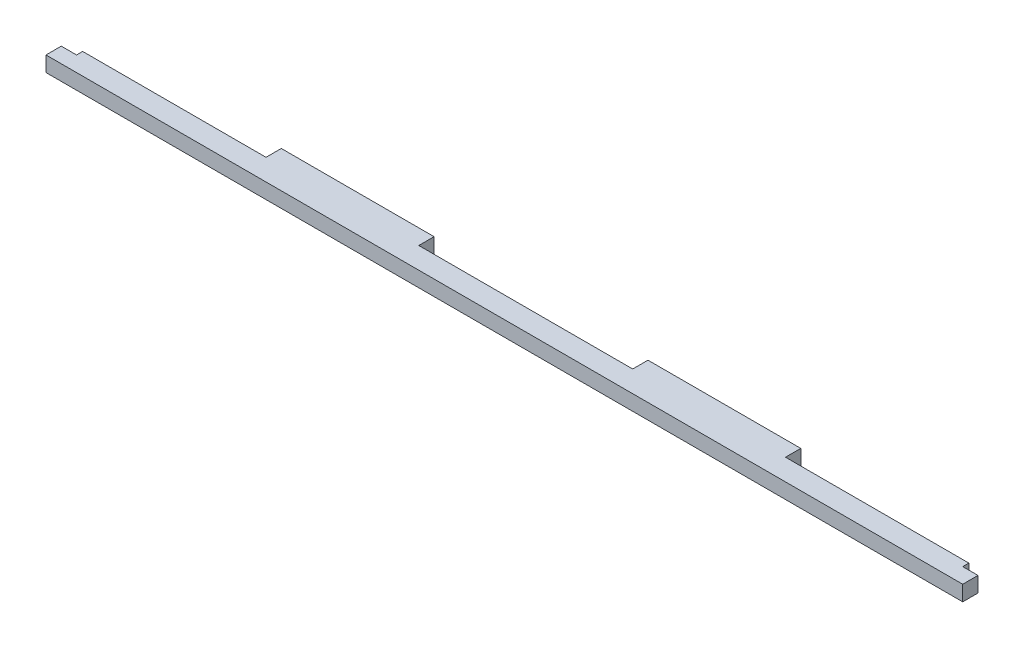
from build123d import *

# Parameters (mm, degrees)
EXTRUDE_1_DEPTH = 5


with BuildPart() as part:
    # 草图1 → 凸台-拉伸1 (new body)
    with BuildSketch(Plane(origin=(0, 0, 0), x_dir=(1, 0, 0), z_dir=(0, 1, 0))):
        Polygon((115, 7), (185, 7), (185, 12), (235, 12), (235, 7), (295, 7), (295, 5), (300, 5), (300, 0), (0, 0), (0, 5), (5, 5), (5, 7), (65, 7), (65, 12), (115, 12), align=None)
    extrude(amount=EXTRUDE_1_DEPTH)


solid = part.part
